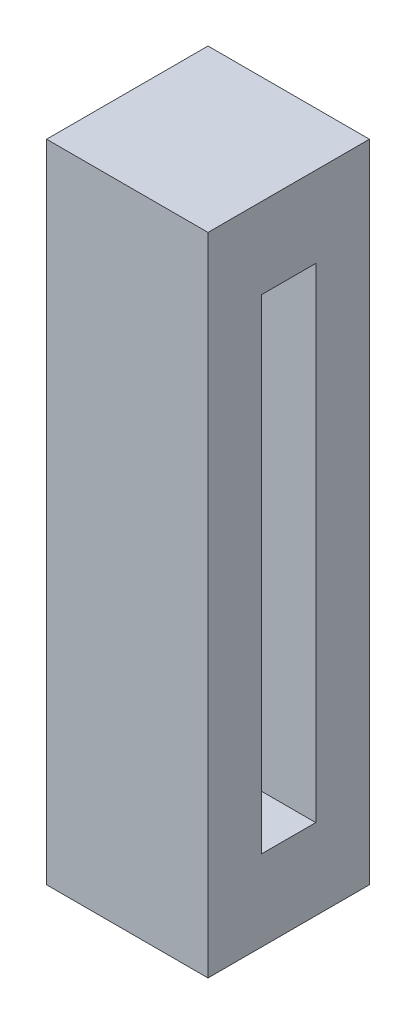
from build123d import *

# Parameters (mm, degrees)
SKETCH1_W           = 2
SKETCH1_H           = 8
BOSS_EXTRUDE1_DEPTH = 2
SKETCH2_W           = 0.67
SKETCH2_H           = 6
CUT_EXTRUDE1_DEPTH  = 3


with BuildPart() as part:
    # Sketch1 → Boss-Extrude1 (new body)
    with BuildSketch(Plane.XY):
        Rectangle(SKETCH1_W, SKETCH1_H)
    extrude(amount=BOSS_EXTRUDE1_DEPTH)

    # Sketch2 → Cut-Extrude1 (cut)
    with BuildSketch(Plane.ZY.offset(1)):
        with Locations((1, 0)):
            Rectangle(SKETCH2_W, SKETCH2_H)
    extrude(amount=-CUT_EXTRUDE1_DEPTH, mode=Mode.SUBTRACT)


solid = part.part
